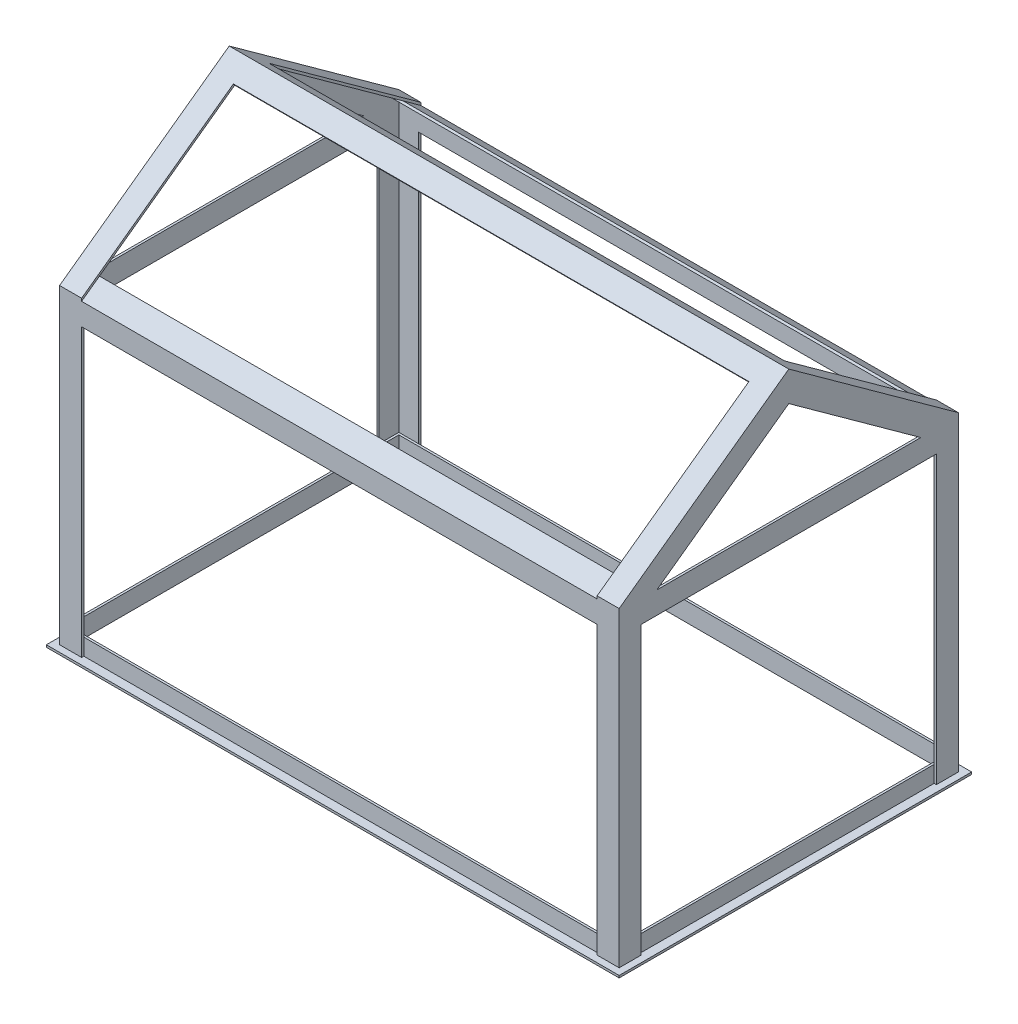
from build123d import *

# Parameters (mm, degrees)
SKIZZE1_W                        = 520
SKIZZE1_H                        = 320
SKIZZE1_W_2                      = 500
SKIZZE1_H_2                      = 300
AUFSATZ_LINEAR_AUSTRAGEN1_DEPTH  = 2
SKIZZE2_W                        = 504
SKIZZE2_H                        = 304
SKIZZE2_W_2                      = 500
SKIZZE2_H_2                      = 300
AUFSATZ_LINEAR_AUSTRAGEN2_DEPTH  = 15
AUFSATZ_LINEAR_AUSTRAGEN3_DEPTH  = 280
AUFSATZ_LINEAR_AUSTRAGEN4_REACH  = 654.656
SKIZZE4_W                        = 2
SKIZZE4_H                        = 20
AUFSATZ_LINEAR_AUSTRAGEN5_REACH  = 662.576
SKIZZE5_W                        = 2
SKIZZE5_H                        = 20
AUFSATZ_LINEAR_AUSTRAGEN7_DEPTH  = 2
AUFSATZ_LINEAR_AUSTRAGEN12_DEPTH = 254
AUFSATZ_LINEAR_AUSTRAGEN13_DEPTH = 254
AUFSATZ_LINEAR_AUSTRAGEN16_DEPTH = 504
AUFSATZ_LINEAR_AUSTRAGEN17_REACH = 737.316
SKIZZE12_W                       = 20
SKIZZE12_H                       = 2
AUFSATZ_LINEAR_AUSTRAGEN18_REACH = 624.098
SKIZZE13_W                       = 20
SKIZZE13_H                       = 2


with BuildPart() as part:
    # Skizze1 → Aufsatz-Linear austragen1 (new body)
    with BuildSketch(Plane(origin=(0, 0, 0), x_dir=(1, 0, 0), z_dir=(0, 1, 0))):
        with Locations((260, 160)):
            Rectangle(SKIZZE1_W, SKIZZE1_H)
        with Locations((260, 160)):
            Rectangle(SKIZZE1_W_2, SKIZZE1_H_2, mode=Mode.SUBTRACT)
    extrude(amount=AUFSATZ_LINEAR_AUSTRAGEN1_DEPTH)

    # Skizze2 → Aufsatz-Linear austragen2 (add)
    with BuildSketch(Plane(origin=(0, 2, 0), x_dir=(1, 0, 0), z_dir=(0, 1, 0))):
        with Locations((260, 160)):
            Rectangle(SKIZZE2_W, SKIZZE2_H)
        with Locations((260, 160)):
            Rectangle(SKIZZE2_W_2, SKIZZE2_H_2, mode=Mode.SUBTRACT)
    extrude(amount=AUFSATZ_LINEAR_AUSTRAGEN2_DEPTH)

    # Skizze3 → Aufsatz-Linear austragen3 (add)
    with BuildSketch(Plane(origin=(0, 2, 0), x_dir=(1, 0, 0), z_dir=(0, 1, 0))):
        Polygon((8, 294), (6, 294), (6, 314), (26, 314), (26, 312), (8, 312), align=None)
        Polygon((512, 312), (512, 294), (514, 294), (514, 314), (494, 314), (494, 312), align=None)
        Polygon((512, 26), (514, 26), (514, 6), (494, 6), (494, 8), (512, 8), align=None)
        Polygon((8, 8), (8, 26), (6, 26), (6, 6), (26, 6), (26, 8), align=None)
    extrude(amount=AUFSATZ_LINEAR_AUSTRAGEN3_DEPTH)

    # Skizze4 → Aufsatz-Linear austragen4 (add, up to next)
    with BuildSketch(Plane(origin=(26, 0, 0), x_dir=(0, 0, -1), z_dir=(1, 0, 0)), mode=Mode.PRIVATE) as aufsatz_linear_austragen4_sk1:
        with Locations((7, 272)):
            Rectangle(SKIZZE4_W, SKIZZE4_H)
    aufsatz_linear_austragen4_tool1 = extrude(aufsatz_linear_austragen4_sk1.sketch, amount=AUFSATZ_LINEAR_AUSTRAGEN4_REACH, mode=Mode.PRIVATE) - part.part
    aufsatz_linear_austragen4 = aufsatz_linear_austragen4_tool1.solids().sort_by_distance((26, 272, -7))[0]
    add(aufsatz_linear_austragen4)

    # Spiegeln1: Aufsatz-Linear austragen4 across plane
    add(aufsatz_linear_austragen4.mirror(Plane.XY.offset(-160)))

    # Skizze5 → Aufsatz-Linear austragen5 (add, up to next)
    with BuildSketch(Plane.XY.offset(-294), mode=Mode.PRIVATE) as aufsatz_linear_austragen5_sk1:
        with Locations((513, 272)):
            Rectangle(SKIZZE5_W, SKIZZE5_H)
    aufsatz_linear_austragen5_tool1 = extrude(aufsatz_linear_austragen5_sk1.sketch, amount=AUFSATZ_LINEAR_AUSTRAGEN5_REACH, mode=Mode.PRIVATE) - part.part
    aufsatz_linear_austragen5 = aufsatz_linear_austragen5_tool1.solids().sort_by_distance((513, 272, -294))[0]
    add(aufsatz_linear_austragen5)

    # Spiegeln2: Aufsatz-Linear austragen5 across plane
    add(aufsatz_linear_austragen5.mirror(Plane(origin=(260, 0, 0), x_dir=(0, 0, 1), z_dir=(1, 0, 0))))

    # Skizze7 → Aufsatz-Linear austragen7 (add)
    with BuildSketch(Plane.ZY.offset(-6)):
        Polygon((-314, 282), (-160, 393.283421946), (-6, 282), (-40.147044848, 282), (-160, 368.608097271), (-279.852955152, 282), align=None)
    aufsatz_linear_austragen7 = extrude(amount=-AUFSATZ_LINEAR_AUSTRAGEN7_DEPTH)

    # Spiegeln5: Aufsatz-Linear austragen7 across plane
    add(aufsatz_linear_austragen7.mirror(Plane(origin=(260, 0, 0), x_dir=(0, 0, 1), z_dir=(1, 0, 0))))

    # Skizze8 → Aufsatz-Linear austragen12 (add)
    with BuildSketch(Plane(origin=(260, 0, 0), x_dir=(0, 0, -1), z_dir=(1, 0, 0))):
        Polygon((175.039121874, 382.415857367), (160, 393.283421946), (144.960878126, 382.415857367), (143.789473684, 384.036909998), (160, 395.750954413), (176.210526316, 384.036909998), align=None)
    extrude(amount=AUFSATZ_LINEAR_AUSTRAGEN12_DEPTH)

    # Skizze8<2> → Aufsatz-Linear austragen13 (add)
    with BuildSketch(Plane(origin=(260, 0, 0), x_dir=(0, 0, -1), z_dir=(1, 0, 0))):
        Polygon((175.039121874, 382.415857367), (160, 393.283421946), (144.960878126, 382.415857367), (143.789473684, 384.036909998), (160, 395.750954413), (176.210526316, 384.036909998), align=None)
    extrude(amount=-AUFSATZ_LINEAR_AUSTRAGEN13_DEPTH)

    # Skizze11 → Aufsatz-Linear austragen16 (add)
    with BuildSketch(Plane.ZY.offset(-512)):
        Polygon((-314, 282), (-312, 282), (-312, 280), (-310.585295515, 280), (-310.585295515, 282), (-296.618069243, 292.092991784), (-297.789473684, 293.714044415), align=None)
    aufsatz_linear_austragen16 = extrude(amount=AUFSATZ_LINEAR_AUSTRAGEN16_DEPTH)

    # Spiegeln6: Aufsatz-Linear austragen16 across plane
    add(aufsatz_linear_austragen16.mirror(Plane.XY.offset(-160)))

    # Aufsatz-Linear austragen17: up to this plane
    aufsatz_linear_austragen17_end = Plane(origin=(6, 282, -314), z_dir=(0, 0, 1))
    # Skizze12 → Aufsatz-Linear austragen17 (add, up to the surface)
    with BuildSketch(Plane(origin=(0, 48.090839316, 66.550696637), x_dir=(-1, 0, 0), z_dir=(0, -0.5857022207681483, -0.8105263157894748)), mode=Mode.PRIVATE) as aufsatz_linear_austragen17_sk1:
        with Locations((-16, 413.478918374)):
            Rectangle(SKIZZE12_W, SKIZZE12_H)
    aufsatz_linear_austragen17_tool1 = split(extrude(aufsatz_linear_austragen17_sk1.sketch, amount=AUFSATZ_LINEAR_AUSTRAGEN17_REACH, mode=Mode.PRIVATE), bisect_by=aufsatz_linear_austragen17_end, keep=Keep.BOTH, mode=Mode.PRIVATE)
    aufsatz_linear_austragen17 = aufsatz_linear_austragen17_tool1.solids().sort_by_distance((16, 383.226384, -175.624824))[0]
    add(aufsatz_linear_austragen17)

    # Spiegeln10: Aufsatz-Linear austragen17 across plane
    add(aufsatz_linear_austragen17.mirror(Plane(origin=(260, 0, 0), x_dir=(0, 0, 1), z_dir=(1, 0, 0))))

    # Aufsatz-Linear austragen18: up to this plane
    aufsatz_linear_austragen18_end = Plane(origin=(514, 282, -6), z_dir=(0, 0, -1))
    # Skizze13 → Aufsatz-Linear austragen18 (add, up to the surface)
    with BuildSketch(Plane(origin=(0, 200.003499524, -276.775627385), x_dir=(1, 0, 0), z_dir=(0, -0.5857022207681525, 0.8105263157894717)), mode=Mode.PRIVATE) as aufsatz_linear_austragen18_sk1:
        with Locations((16, 226.054207728)):
            Rectangle(SKIZZE13_W, SKIZZE13_H)
    aufsatz_linear_austragen18_tool1 = split(extrude(aufsatz_linear_austragen18_sk1.sketch, amount=AUFSATZ_LINEAR_AUSTRAGEN18_REACH, mode=Mode.PRIVATE), bisect_by=aufsatz_linear_austragen18_end, keep=Keep.BOTH, mode=Mode.PRIVATE)
    aufsatz_linear_austragen18 = aufsatz_linear_austragen18_tool1.solids().sort_by_distance((16, 383.226384, -144.375176))[0]
    add(aufsatz_linear_austragen18)

    # Spiegeln12: Aufsatz-Linear austragen18 across plane
    add(aufsatz_linear_austragen18.mirror(Plane(origin=(260, 0, 0), x_dir=(0, 0, 1), z_dir=(1, 0, 0))))


solid = part.part
